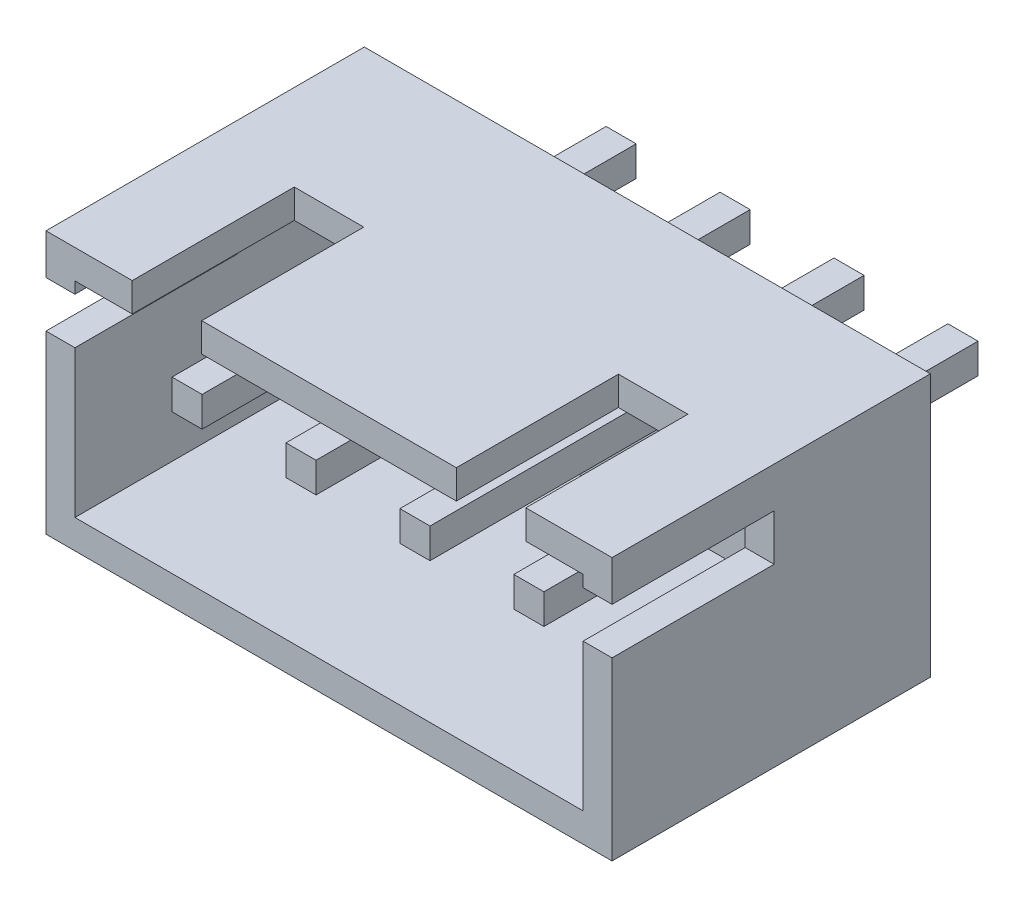
from build123d import *

# Parameters (mm, degrees)
SKETCH1_W           = 12.4206
SKETCH1_H           = 5.7658
BOSS_EXTRUDE1_DEPTH = 6.985
SKETCH2_W           = 0.6604
SKETCH2_H           = 0.6604
BOSS_EXTRUDE2_DEPTH = 3.175
SKETCH4_W           = 11.1506
SKETCH4_H           = 4.4958
CUT_EXTRUDE1_DEPTH  = 6.35
SKETCH2_2_W         = 0.6604
SKETCH2_2_H         = 0.6604
BOSS_EXTRUDE3_DEPTH = 6.35
SKETCH5_W           = 0.635
SKETCH5_H           = 1.016
SKETCH5_W_2         = 1.524
SKETCH5_H_2         = 0.635
CUT_EXTRUDE2_DEPTH  = 3.556


with BuildPart() as part:
    # Sketch1 → Boss-Extrude1 (new body)
    with BuildSketch(Plane.XY):
        with Locations((6.2103, 2.8829)):
            Rectangle(SKETCH1_W, SKETCH1_H)
    extrude(amount=BOSS_EXTRUDE1_DEPTH)

    # Sketch2 → Boss-Extrude2 (add)
    with BuildSketch(Plane(origin=(0, 0, 0), x_dir=(-1, 0, 0), z_dir=(0, 0, -1))):
        with Locations((-9.9603, 3.4036)):
            Rectangle(SKETCH2_W, SKETCH2_H)
        with Locations((-7.4603, 3.4036)):
            Rectangle(SKETCH2_W, SKETCH2_H)
        with Locations((-4.9603, 3.4036)):
            Rectangle(SKETCH2_W, SKETCH2_H)
        with Locations((-2.4603, 3.4036)):
            Rectangle(SKETCH2_W, SKETCH2_H)
    extrude(amount=BOSS_EXTRUDE2_DEPTH)

    # Sketch4 → Cut-Extrude1 (cut)
    with BuildSketch(Plane.XY.offset(6.985)):
        with Locations((6.2103, 2.8829)):
            Rectangle(SKETCH4_W, SKETCH4_H)
    extrude(amount=-CUT_EXTRUDE1_DEPTH, mode=Mode.SUBTRACT)

    # Sketch2<2> → Boss-Extrude3 (add)
    with BuildSketch(Plane(origin=(0, 0, 0), x_dir=(-1, 0, 0), z_dir=(0, 0, -1))):
        with Locations((-9.9603, 3.4036)):
            Rectangle(SKETCH2_2_W, SKETCH2_2_H)
        with Locations((-7.4603, 3.4036)):
            Rectangle(SKETCH2_2_W, SKETCH2_2_H)
        with Locations((-4.9603, 3.4036)):
            Rectangle(SKETCH2_2_W, SKETCH2_2_H)
        with Locations((-2.4603, 3.4036)):
            Rectangle(SKETCH2_2_W, SKETCH2_2_H)
    extrude(amount=-BOSS_EXTRUDE3_DEPTH)

    # Sketch5 → Cut-Extrude2 (cut)
    with BuildSketch(Plane.XY.offset(6.985)):
        with Locations((0.3175, 4.3688)):
            Rectangle(SKETCH5_W, SKETCH5_H)
        with Locations((12.1031, 4.3688)):
            Rectangle(SKETCH5_W, SKETCH5_H)
        with Locations((9.7663, 5.4483)):
            Rectangle(SKETCH5_W_2, SKETCH5_H_2)
        with Locations((2.6543, 5.4483)):
            Rectangle(SKETCH5_W_2, SKETCH5_H_2)
    extrude(amount=-CUT_EXTRUDE2_DEPTH, mode=Mode.SUBTRACT)


solid = part.part
